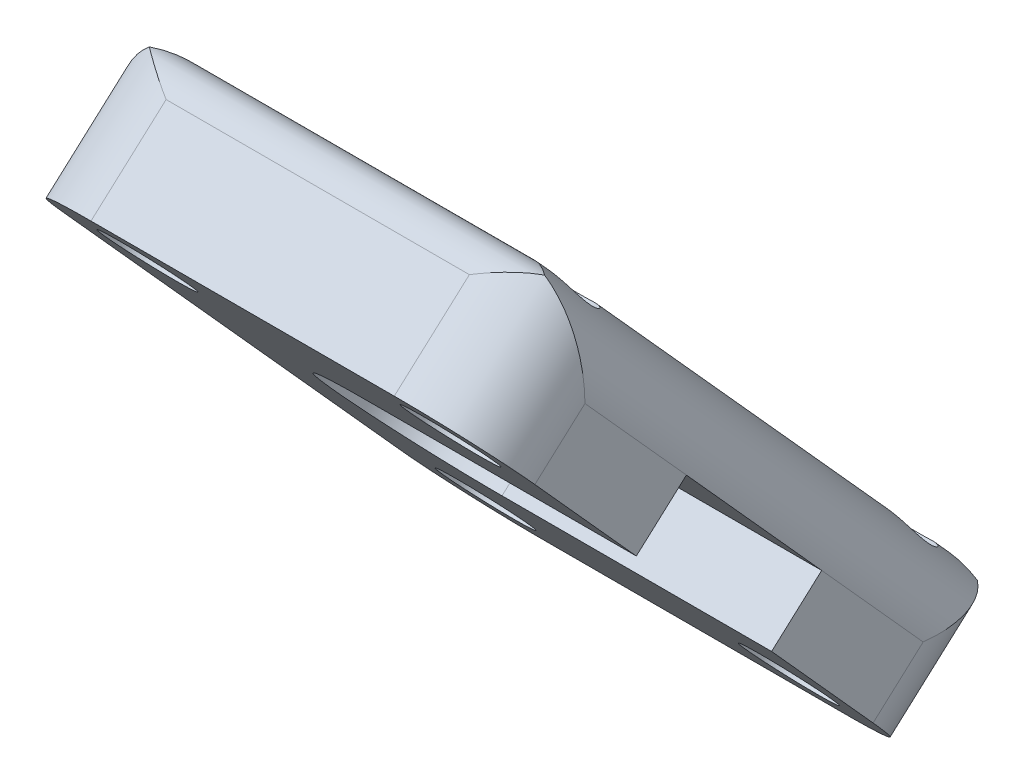
from build123d import *

# Parameters (mm, degrees)
EXTRUDE_1_DEPTH     = 40
SKETCH_3_R          = 2.5
CUT_EXTRUDE_1_DEPTH = 44.127717306
SKETCH_5_OUTSIDE_W  = 39.896
SKETCH_5_OUTSIDE_H  = 51.896
CUT_EXTRUDE_3_DEPTH = 44.127717449
CUT_EXTRUDE_4_DEPTH = 4
MOVE_BODY_1_ANGLE   = 48
SKETCH_7_OUTSIDE_W  = 45.818
SKETCH_7_OUTSIDE_H  = 48.186
CUT_EXTRUDE_6_DEPTH = 50


with BuildPart() as part:
    # 草图2 → 凸台-拉伸1 (new body)
    with BuildSketch(Plane.XY):
        with BuildLine():
            Line((14, 0), (-14, 0))
            Line((-14, 0), (-14, 4))
            ThreePointArc((-14, 4), (-12.828427125, 6.828427125), (-10, 8))
            Line((-10, 8), (10, 8))
            ThreePointArc((10, 8), (12.828427125, 6.828427125), (14, 4))
            Line((14, 4), (14, 0))
        make_face()
    extrude(amount=-EXTRUDE_1_DEPTH)

    # 草图3 → 切除-拉伸1 (cut, through all)
    with BuildSketch(Plane(origin=(0, 0, 0), x_dir=(1, 0, 0), z_dir=(0, 1, 0))):
        with Locations(Location((-9, 35, 0), (0, 0, 113.578178478))):
            Circle(SKETCH_3_R)
        with Locations(Location((9, 35, 0), (0, 0, 66.421821522))):
            Circle(SKETCH_3_R)
        with Locations(Location((-9, 5, 0), (0, 0, 113.578178478))):
            Circle(SKETCH_3_R)
        with Locations(Location((9, 5, 0), (0, 0, 66.421821522))):
            Circle(SKETCH_3_R)
    extrude(amount=CUT_EXTRUDE_1_DEPTH, mode=Mode.SUBTRACT)

    # 草图5 outside → 切除-拉伸3 (cut, through all)
    with BuildSketch(Plane(origin=(0, 8, 0), x_dir=(1, 0, 0), z_dir=(0, 1, 0))):
        with Locations((0, 20)):
            Rectangle(SKETCH_5_OUTSIDE_W, SKETCH_5_OUTSIDE_H)
        with BuildLine():
            Line((14, 5), (14, 35))
            ThreePointArc((14, 35), (12.535533906, 38.535533906), (9, 40))
            Line((9, 40), (-9, 40))
            ThreePointArc((-9, 40), (-12.535533906, 38.535533906), (-14, 35))
            Line((-14, 35), (-14, 5))
            ThreePointArc((-14, 5), (-12.535533906, 1.464466094), (-9, 0))
            Line((-9, 0), (9, 0))
            ThreePointArc((9, 0), (12.535533906, 1.464466094), (14, 5))
        make_face(mode=Mode.SUBTRACT)
    extrude(amount=-CUT_EXTRUDE_3_DEPTH, mode=Mode.SUBTRACT)

    # 草图6 → 切除-拉伸4 (cut)
    with BuildSketch(Plane.XZ):
        with BuildLine():
            Line((14, -26), (-2, -26))
            ThreePointArc((-2, -26), (-8, -20), (-2, -14))
            Line((-2, -14), (14, -14))
            ThreePointArc((14, -14), (20, -20), (14, -26))
        make_face()
    extrude(amount=-CUT_EXTRUDE_4_DEPTH, mode=Mode.SUBTRACT)


with BuildPart() as part_1:
    # Move Body 1: moved
    add(part.part.rotate(Axis((0, 4, -20), (-1, 0, 0)), MOVE_BODY_1_ANGLE))

    # 草图7 outside → 切除-拉伸6 (cut)
    with BuildSketch(Plane.ZY.offset(14)):
        with Locations((-20, 4)):
            Rectangle(SKETCH_7_OUTSIDE_W, SKETCH_7_OUTSIDE_H)
        with BuildLine():
            Line((-6.990461603, 12.470649957), (-3.644808571, 16.186374084))
            Line((-3.644808571, 16.186374084), (-8.103677524, 20.201157722))
            ThreePointArc((-8.103677524, 20.201157722), (-9.546610649, 20.712127141), (-10.928228387, 20.053129284))
            Line((-10.928228387, 20.053129284), (-11.40244938, 19.526453515))
            Line((-11.40244938, 19.526453515), (-14.468791033, 16.1209361))
            Line((-14.468791033, 16.1209361), (-31.476367571, -2.767891249))
            Line((-31.476367571, -2.767891249), (-34.542709224, -6.173408664))
            Line((-34.542709224, -6.173408664), (-35.016930216, -6.700084433))
            ThreePointArc((-35.016930216, -6.700084433), (-35.527899635, -8.143017558), (-34.868901778, -9.524635297))
            Line((-34.868901778, -9.524635297), (-30.410032825, -13.539418935))
            Line((-30.410032825, -13.539418935), (-27.064379793, -9.823694808))
            Line((-27.064379793, -9.823694808), (-6.990461603, 12.470649957))
        make_face(mode=Mode.SUBTRACT)
    extrude(amount=-CUT_EXTRUDE_6_DEPTH, mode=Mode.SUBTRACT)


solid = part_1.part
